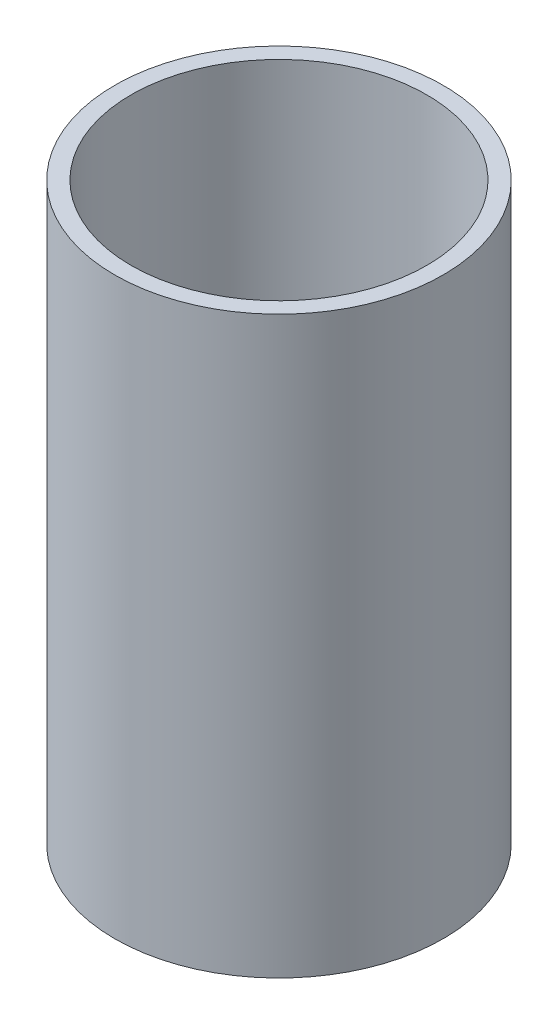
from build123d import *

# Parameters (mm, degrees)
SKETCH_1_R      = 20
SKETCH_1_R_2    = 18
EXTRUDE_1_DEPTH = 70


with BuildPart() as part:
    # 草图1 → 凸台-拉伸1 (new body)
    with BuildSketch(Plane(origin=(0, 0, 0), x_dir=(1, 0, 0), z_dir=(0, 1, 0))):
        with Locations(Location((0, 0, 0), (0, 0, 270))):
            Circle(SKETCH_1_R)
        with Locations(Location((0, 0, 0), (0, 0, 270))):
            Circle(SKETCH_1_R_2, mode=Mode.SUBTRACT)
    extrude(amount=EXTRUDE_1_DEPTH)


solid = part.part
